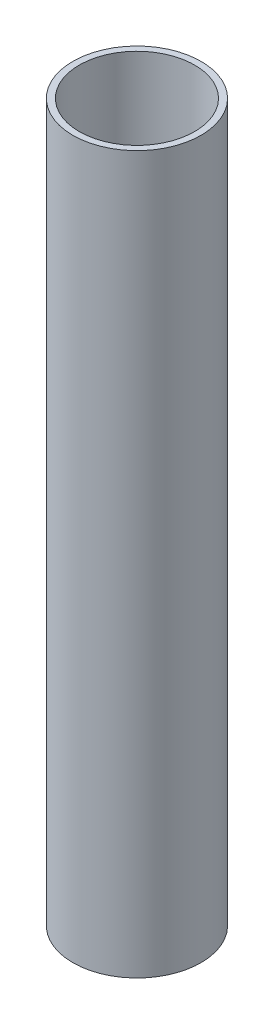
from build123d import *

# Parameters (mm, degrees)
SKETCH1_R           = 10
SKETCH1_R_2         = 9
BOSS_EXTRUDE1_DEPTH = 111.8


with BuildPart() as part:
    # Sketch1 → Boss-Extrude1 (new body)
    with BuildSketch(Plane(origin=(0, 0, 0), x_dir=(1, 0, 0), z_dir=(0, 1, 0))):
        with Locations(Location((0, 0, 0), (0, 0, 270))):
            Circle(SKETCH1_R)
        with Locations(Location((0, 0, 0), (0, 0, 270))):
            Circle(SKETCH1_R_2, mode=Mode.SUBTRACT)
    extrude(amount=BOSS_EXTRUDE1_DEPTH)


solid = part.part
